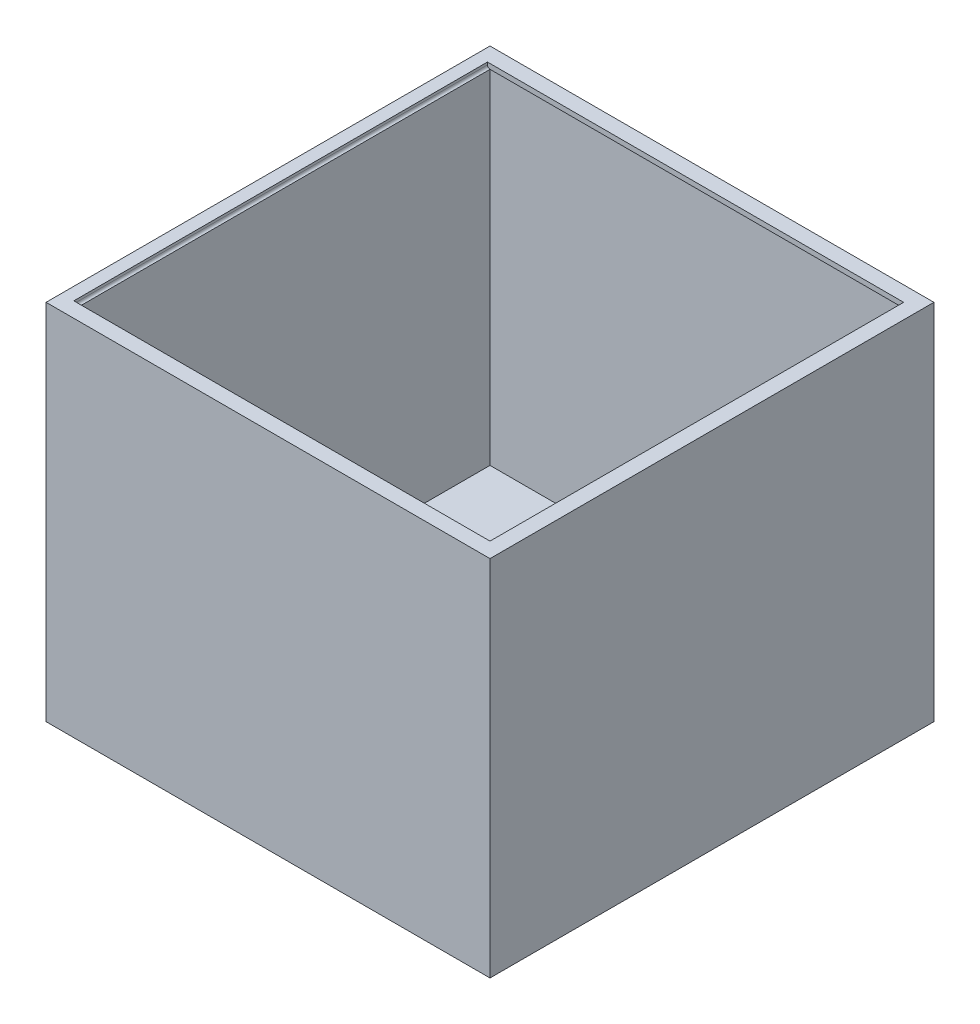
from build123d import *

# Parameters (mm, degrees)
SKETCH_1_W                      = 440
SKETCH_1_H                      = 440
SKETCH_1_W_2                    = 430
SKETCH_1_H_2                    = 430
EXTRUDE_1_DEPTH                 = 360
SKETCH_2_W                      = 440
SKETCH_2_H                      = 440
EXTRUDE_2_DEPTH                 = 5
SKETCH_3_W                      = 440
SKETCH_3_H                      = 440
SKETCH_3_W_2                    = 410
SKETCH_3_H_2                    = 410
EXTRUDE_3_DEPTH                 = 5
CUT_EXTRUDE_1_REACH             = 434.204
CUT_EXTRUDE_1_DIRECTION_2_REACH = 434.204


with BuildPart() as part:
    # Эскиз1 → Бобышка-Вытянуть1 (new body)
    with BuildSketch(Plane(origin=(0, -60, 0), x_dir=(1, 0, 0), z_dir=(0, 1, 0))):
        Rectangle(SKETCH_1_W, SKETCH_1_H)
        Rectangle(SKETCH_1_W_2, SKETCH_1_H_2, mode=Mode.SUBTRACT)
    extrude(amount=EXTRUDE_1_DEPTH)

    # Эскиз2 → Бобышка-Вытянуть2 (add)
    with BuildSketch(Plane(origin=(0, -60, 0), x_dir=(1, 0, 0), z_dir=(0, 1, 0))):
        Rectangle(SKETCH_2_W, SKETCH_2_H)
    extrude(amount=EXTRUDE_2_DEPTH)

    # Эскиз3 → Бобышка-Вытянуть3 (add)
    with BuildSketch(Plane(origin=(0, 300, 0), x_dir=(1, 0, 0), z_dir=(0, 1, 0))):
        Rectangle(SKETCH_3_W, SKETCH_3_H)
        Rectangle(SKETCH_3_W_2, SKETCH_3_H_2, mode=Mode.SUBTRACT)
    extrude(amount=-EXTRUDE_3_DEPTH)

    # Вырез-Вытянуть1: up to this face of the body (flat: up to its plane)
    cut_extrude_1_end = Plane(part.part.faces().sort_by_distance((0, 297.5, -205))[0])
    # Эскиз4 → Вырез-Вытянуть1 (cut, up to the picked face)
    with BuildSketch(Plane.XY, mode=Mode.PRIVATE) as cut_extrude_1_sk1:
        with BuildLine():
            Line((-205, 295), (-205, 300))
            Line((-205, 300), (-207.5, 300))
            Line((-207.5, 300), (-207.5, 297.5))
            ThreePointArc((-207.5, 297.5), (-206.767766953, 295.732233047), (-205, 295))
        make_face()
    cut_extrude_1_tool1 = split(extrude(cut_extrude_1_sk1.sketch, amount=-CUT_EXTRUDE_1_REACH, mode=Mode.PRIVATE), bisect_by=cut_extrude_1_end, keep=Keep.BOTH, mode=Mode.PRIVATE)
    add(cut_extrude_1_tool1.solids().sort_by(Axis((-206.166873, 297.733375, 0), (0, 0, -1)))[0], mode=Mode.SUBTRACT)

    # Вырез-Вытянуть1 direction 2: up to this face of the body (flat: up to its plane)
    cut_extrude_1_direction_2_end = Plane(part.part.faces().sort_by_distance((0, 297.5, 205))[0])
    # Эскиз4 → Вырез-Вытянуть1 direction 2 (cut, up to the picked face)
    with BuildSketch(Plane.XY, mode=Mode.PRIVATE) as cut_extrude_1_direction_2_sk1:
        with BuildLine():
            Line((-205, 295), (-205, 300))
            Line((-205, 300), (-207.5, 300))
            Line((-207.5, 300), (-207.5, 297.5))
            ThreePointArc((-207.5, 297.5), (-206.767766953, 295.732233047), (-205, 295))
        make_face()
    cut_extrude_1_direction_2_tool1 = split(extrude(cut_extrude_1_direction_2_sk1.sketch, amount=CUT_EXTRUDE_1_DIRECTION_2_REACH, mode=Mode.PRIVATE), bisect_by=cut_extrude_1_direction_2_end, keep=Keep.BOTH, mode=Mode.PRIVATE)
    add(cut_extrude_1_direction_2_tool1.solids().sort_by(Axis((-206.166873, 297.733375, 0), (0, 0, 1)))[0], mode=Mode.SUBTRACT)


solid = part.part
